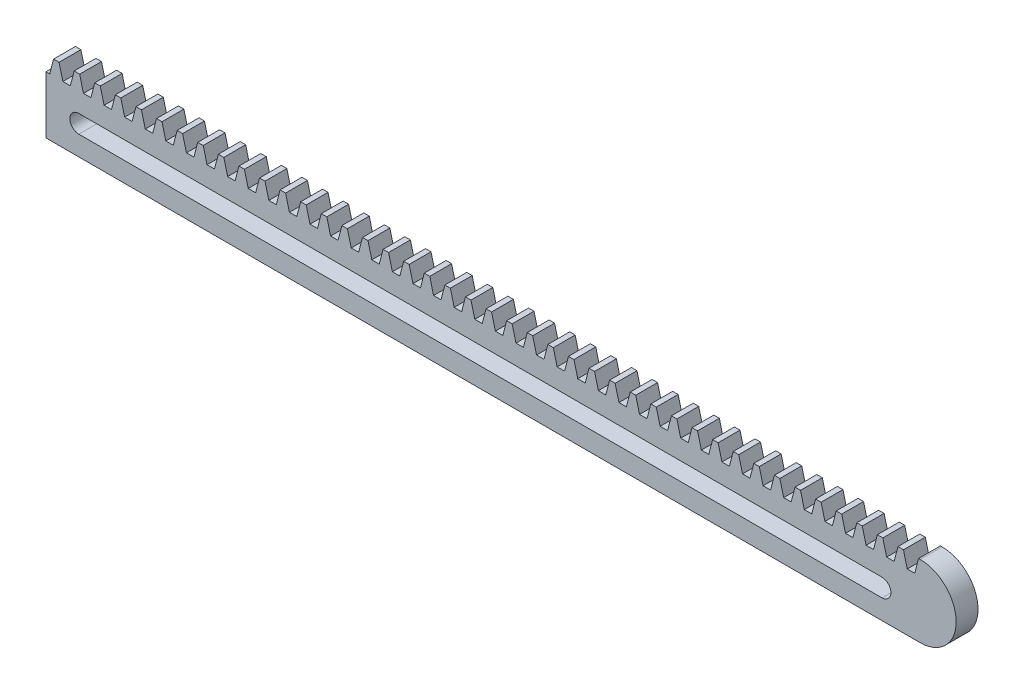
from build123d import *

# Parameters (mm, degrees)
BLANKSKE_W          = 400
BLANKSKE_H          = 33
BLANK_DEPTH         = 10
TOOTHCUTSIM_DEPTH   = 402.483499038
TEETHCUTS_COUNT     = 43
TEETHCUTS_PITCH     = 9.42477795
CUT_EXTRUDE1_DEPTH  = 402.483499038
BOSS_EXTRUDE1_DEPTH = 10


with BuildPart() as part:
    # BlankSke → Blank (new body)
    with BuildSketch(Plane.XY):
        with Locations((200, 16.5)):
            Rectangle(BLANKSKE_W, BLANKSKE_H)
    extrude(amount=-BLANK_DEPTH)

    # TooCutSkeSim → ToothCutSim (cut, through all)
    with BuildSketch(Plane.XY):
        Polygon((1.707378546, 26.25), (-1.707378546, 26.25), (-3.459616127, 33.0254), (3.459616127, 33.0254), align=None)
    toothcutsim = extrude(amount=-TOOTHCUTSIM_DEPTH, mode=Mode.SUBTRACT)

    # TeethCuts: ToothCutSim ×43
    with Locations(*[(i * TEETHCUTS_PITCH, 0, 0) for i in range(1, TEETHCUTS_COUNT)]):
        add(toothcutsim, mode=Mode.SUBTRACT)

    # Sketch1 → Cut-Extrude1 (cut, through all)
    with BuildSketch(Plane.XY):
        with BuildLine():
            Line((15, 17.225), (382.548052446, 17.225))
            ThreePointArc((382.548052446, 17.225), (386.648052446, 13.125), (382.548052446, 9.025))
            Line((382.548052446, 9.025), (15, 9.025))
            ThreePointArc((15, 9.025), (10.9, 13.125), (15, 17.225))
        make_face()
    extrude(amount=-CUT_EXTRUDE1_DEPTH, mode=Mode.SUBTRACT)

    # Sketch2 → Boss-Extrude1 (add)
    with BuildSketch(Plane(origin=(0, 0, -10), x_dir=(-1, 0, 0), z_dir=(0, 0, -1))):
        with BuildLine():
            Line((-400, 33), (-400, 0))
            ThreePointArc((-400, 0), (-416.5, 16.5), (-400, 33))
        make_face()
    extrude(amount=-BOSS_EXTRUDE1_DEPTH)


solid = part.part
